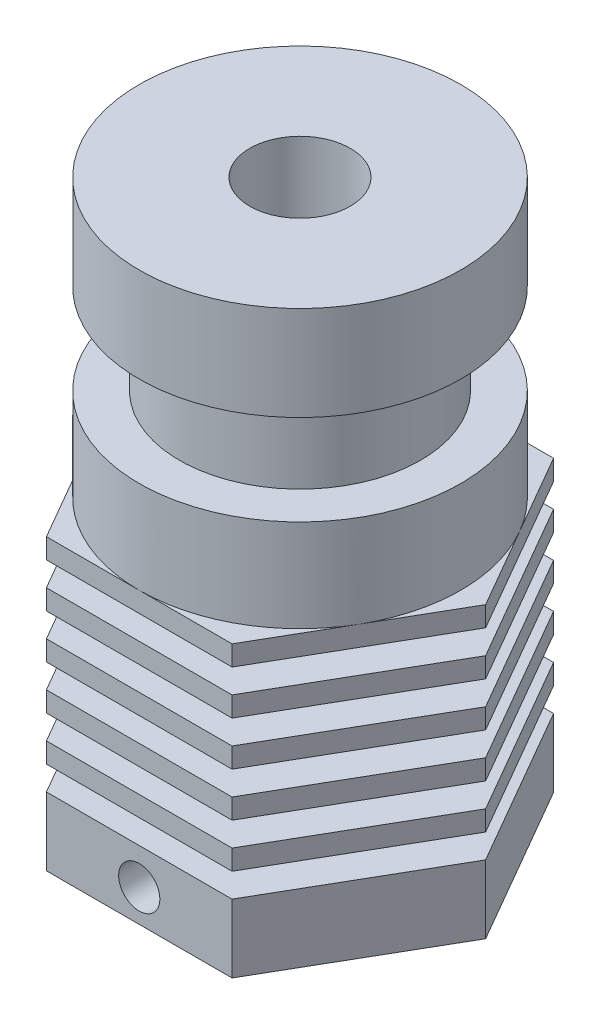
from build123d import *

# Parameters (mm, degrees)
SKETCH2_OUTSIDE_W            = 40.48
SKETCH2_OUTSIDE_H            = 40.48
CUT_EXTRUDE1_DEPTH           = 25.835147333
M6X1_0_TAPPED_HOLE1_D        = 5
M6X1_0_TAPPED_HOLE1_DEPTH    = 5
M6X1_0_TAPPED_HOLE1_TIP      = 1.502151548
M2_5X0_45_TAPPED_HOLE1_D     = 2.05
M2_5X0_45_TAPPED_HOLE1_DEPTH = 9
M2_5X0_45_TAPPED_HOLE1_TIP   = 0.615882135


with BuildPart() as part:
    # Sketch1 → Revolve1 (revolve)
    with BuildSketch(Plane.XY, mode=Mode.PRIVATE) as revolve1_sk:
        Polygon((3, 0), (3, 3.2), (2.05, 3.2), (2.05, 28.2), (8, 28.2), (8, 23.5), (6, 23.5), (6, 19), (8, 19), (8, 14.4), (14.307769621, 14.4), (14.307769621, 13.4), (4.75, 13.4), (4.75, 12.2), (14.307769621, 12.2), (14.307769621, 11.2), (4.75, 11.2), (4.75, 10), (14.307769621, 10), (14.307769621, 9), (4.75, 9), (4.75, 7.8), (14.307769621, 7.8), (14.307769621, 6.8), (4.75, 6.8), (4.75, 5.6), (14.307769621, 5.6), (14.307769621, 4.6), (4.75, 4.6), (4.75, 3.4), (14.307769621, 3.4), (14.307769621, 0), align=None)
    revolve(revolve1_sk.sketch.rotate(Axis((0, 0, 0), (0, 1, 0)), 90), axis=Axis((0, 0, 0), (0, 1, 0)))

    # Sketch2 outside → Cut-Extrude1 (cut, through all)
    with BuildSketch(Plane(origin=(0, 14.4, 0), x_dir=(1, 0, 0), z_dir=(0, 1, 0))):
        Rectangle(SKETCH2_OUTSIDE_W, SKETCH2_OUTSIDE_H)
        Polygon((-4.618802154, 8), (-9.237604307, 0), (-4.618802154, -8), (4.618802154, -8), (9.237604307, 0), (4.618802154, 8), align=None, mode=Mode.SUBTRACT)
    extrude(amount=-CUT_EXTRUDE1_DEPTH, mode=Mode.SUBTRACT)

    # M6x1.0 Tapped Hole1
    with Locations(Plane(origin=(0, 28.2, 0), x_dir=(-1, 0, 0), z_dir=(0, 1, 0))):
        with Locations((0, 0)):
            Hole(M6X1_0_TAPPED_HOLE1_D / 2, depth=M6X1_0_TAPPED_HOLE1_DEPTH)
            with Locations((0, 0, -(M6X1_0_TAPPED_HOLE1_DEPTH + M6X1_0_TAPPED_HOLE1_TIP / 2))):  # 118° drill point
                Cone(0, M6X1_0_TAPPED_HOLE1_D / 2, M6X1_0_TAPPED_HOLE1_TIP, mode=Mode.SUBTRACT)

    # M2.5x0.45 Tapped Hole1
    with Locations(Plane.XY.offset(8)):
        with Locations((0, 1.6)):
            Hole(M2_5X0_45_TAPPED_HOLE1_D / 2, depth=M2_5X0_45_TAPPED_HOLE1_DEPTH)
            with Locations((0, 0, -(M2_5X0_45_TAPPED_HOLE1_DEPTH + M2_5X0_45_TAPPED_HOLE1_TIP / 2))):  # 118° drill point
                Cone(0, M2_5X0_45_TAPPED_HOLE1_D / 2, M2_5X0_45_TAPPED_HOLE1_TIP, mode=Mode.SUBTRACT)


solid = part.part
